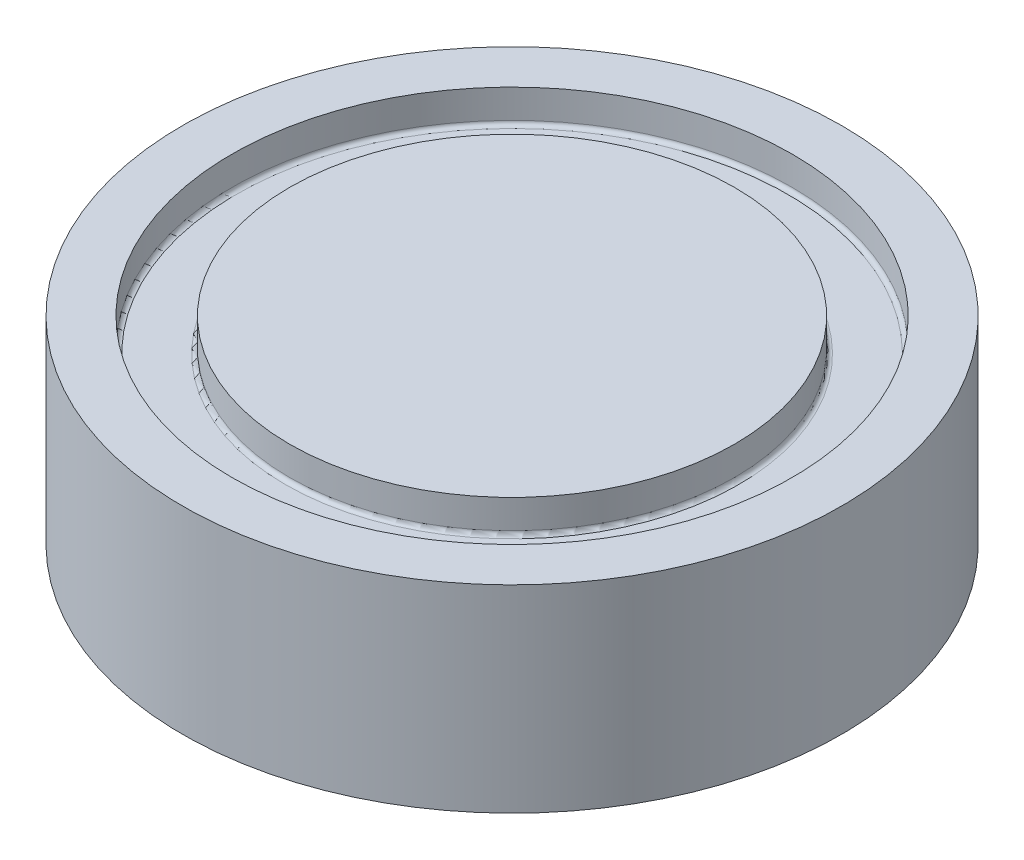
from build123d import *

# Parameters (mm, degrees)
SKETCH1_R                 = 50.8
BOSS_EXTRUDE1_DEPTH       = 30.48
F_1_14_TAPPED_HOLE1_D     = 23.8125
F_1_14_TAPPED_HOLE1_DEPTH = 15.24
F_1_14_TAPPED_HOLE1_TIP   = 7.153996745
SKETCH4_R                 = 43.18
SKETCH4_R_2               = 34.29
CUT_EXTRUDE1_DEPTH        = 5.08
FILLET1_R                 = 0.635


with BuildPart() as part:
    # Sketch1 → Boss-Extrude1 (new body)
    with BuildSketch(Plane(origin=(0, 0, 0), x_dir=(1, 0, 0), z_dir=(0, 1, 0))):
        with Locations(Location((0, 0, 0), (0, 0, 90))):
            Circle(SKETCH1_R)
    extrude(amount=BOSS_EXTRUDE1_DEPTH)

    # 1-14 Tapped Hole1
    with Locations(Plane(origin=(0, 0, 0), x_dir=(-1, 0, 0), z_dir=(0, -1, 0))):
        with Locations((0, 0)):
            Hole(F_1_14_TAPPED_HOLE1_D / 2, depth=F_1_14_TAPPED_HOLE1_DEPTH)
            with Locations((0, 0, -(F_1_14_TAPPED_HOLE1_DEPTH + F_1_14_TAPPED_HOLE1_TIP / 2))):  # 118° drill point
                Cone(0, F_1_14_TAPPED_HOLE1_D / 2, F_1_14_TAPPED_HOLE1_TIP, mode=Mode.SUBTRACT)

    # Sketch4 → Cut-Extrude1 (cut)
    with BuildSketch(Plane(origin=(0, 30.48, 0), x_dir=(1, 0, 0), z_dir=(0, 1, 0))):
        with Locations(Location((0, 0, 0), (0, 0, 270))):
            Circle(SKETCH4_R)
        with Locations(Location((0, 0, 0), (0, 0, 270))):
            Circle(SKETCH4_R_2, mode=Mode.SUBTRACT)
    extrude(amount=-CUT_EXTRUDE1_DEPTH, mode=Mode.SUBTRACT)

    # Fillet1
    fillet1_edges = [part.edges().sort_by_distance(p)[0] for p in [
        (0, 25.4, -43.18),
        (0, 25.4, -34.29),
    ]]
    fillet(fillet1_edges, radius=FILLET1_R)


solid = part.part
